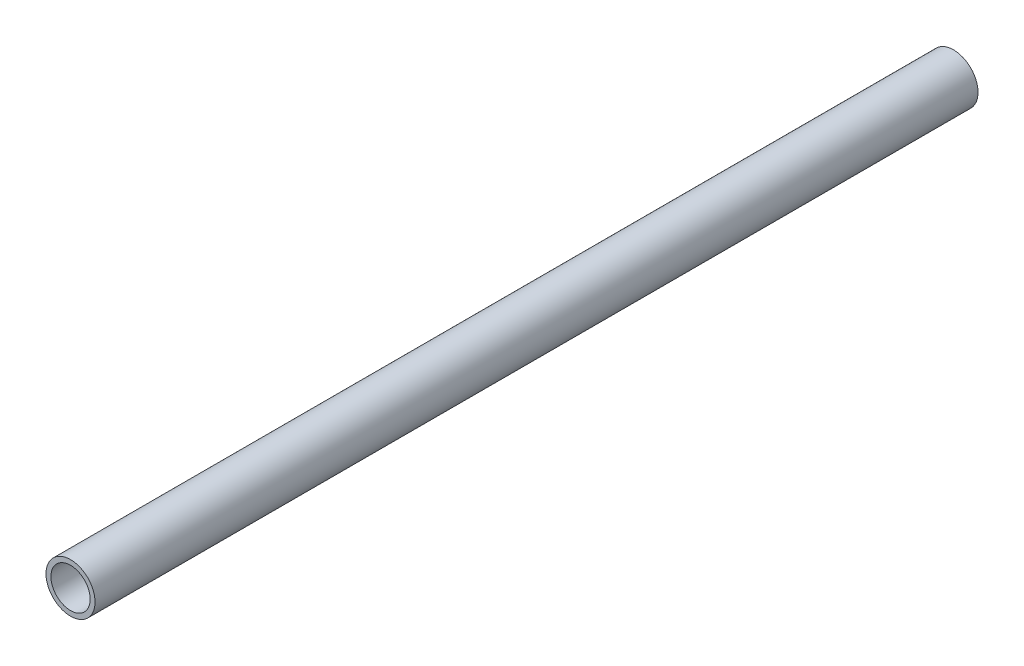
from build123d import *

# Parameters (mm, degrees)
SKETCH_1_R      = 5
SKETCH_1_R_2    = 4
EXTRUDE_1_DEPTH = 180


with BuildPart() as part:
    # 草图1 → 凸台-拉伸1 (new body)
    with BuildSketch(Plane.XY):
        with Locations(Location((0, 0, 0), (0, 0, 180))):
            Circle(SKETCH_1_R)
        with Locations(Location((0, 0, 0), (0, 0, 180))):
            Circle(SKETCH_1_R_2, mode=Mode.SUBTRACT)
    extrude(amount=EXTRUDE_1_DEPTH)


solid = part.part
